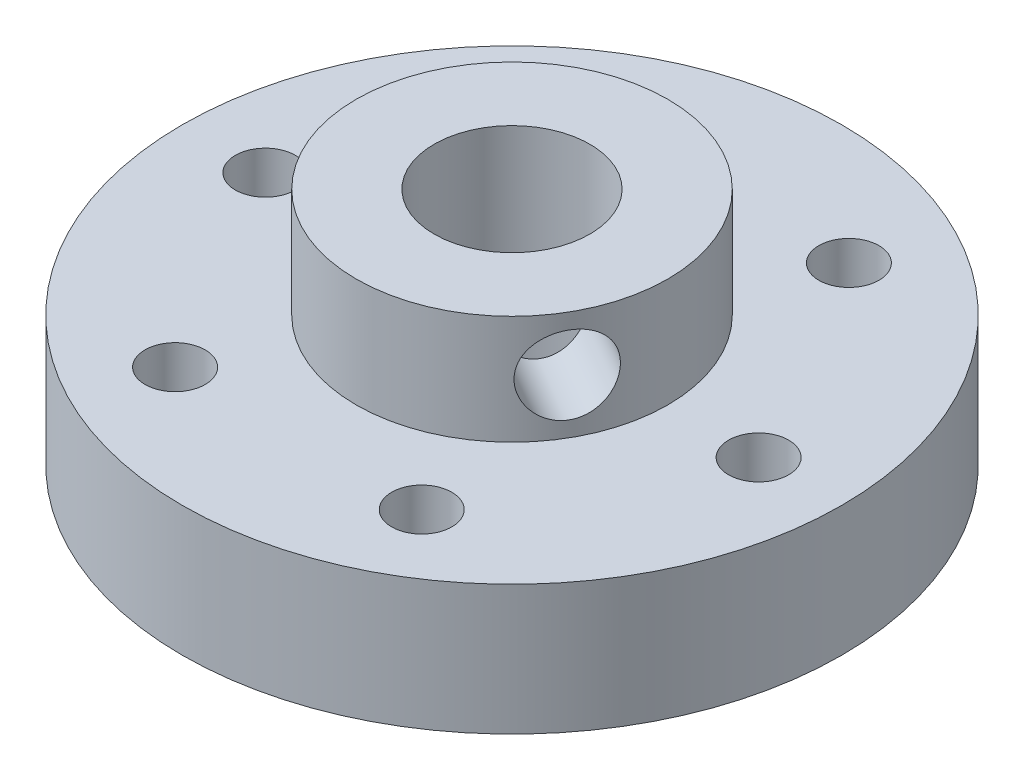
from build123d import *

# Parameters (mm, degrees)
SKETCH1_R           = 12.7
BOSS_EXTRUDE1_DEPTH = 5
SKETCH2_R           = 6
BOSS_EXTRUDE2_DEPTH = 4.2
SKETCH3_R           = 3
CUT_EXTRUDE1_DEPTH  = 21.179692763
SKETCH6_R           = 1.158179442
CUT_EXTRUDE2_DEPTH  = 19.643497526
SKETCH7_R           = 1.5
CUT_EXTRUDE3_DEPTH  = 8.2


with BuildPart() as part:
    # Sketch1 → Boss-Extrude1 (new body)
    with BuildSketch(Plane(origin=(0, 0, 0), x_dir=(1, 0, 0), z_dir=(0, 1, 0))):
        with Locations(Location((0, 0, 0), (0, 0, 270))):
            Circle(SKETCH1_R)
    extrude(amount=BOSS_EXTRUDE1_DEPTH)

    # Sketch2 → Boss-Extrude2 (add)
    with BuildSketch(Plane(origin=(0, 5, 0), x_dir=(1, 0, 0), z_dir=(0, 1, 0))):
        with Locations(Location((0, 0, 0), (0, 0, 270))):
            Circle(SKETCH2_R)
    extrude(amount=BOSS_EXTRUDE2_DEPTH)

    # Sketch3 → Cut-Extrude1 (cut, through all)
    with BuildSketch(Plane(origin=(0, 9.2, 0), x_dir=(1, 0, 0), z_dir=(0, 1, 0))):
        with Locations(Location((0, 0, 0), (0, 0, 270))):
            Circle(SKETCH3_R)
    extrude(amount=-CUT_EXTRUDE1_DEPTH, mode=Mode.SUBTRACT)

    # Sketch6 → Cut-Extrude2 (cut, through all)
    with BuildSketch(Plane(origin=(0, 5, 0), x_dir=(1, 0, 0), z_dir=(0, 1, 0))):
        with Locations(Location((-9.5, 0, 0), (0, 0, 270))):
            Circle(SKETCH6_R)
        with Locations(Location((-4.75, 8.227241336, 0), (0, 0, 270))):
            Circle(SKETCH6_R)
        with Locations(Location((4.75, 8.227241336, 0), (0, 0, 270))):
            Circle(SKETCH6_R)
        with Locations(Location((9.5, 0, 0), (0, 0, 270))):
            Circle(SKETCH6_R)
        with Locations(Location((4.75, -8.227241336, 0), (0, 0, 270))):
            Circle(SKETCH6_R)
        with Locations(Location((-4.75, -8.227241336, 0), (0, 0, 270))):
            Circle(SKETCH6_R)
    extrude(amount=-CUT_EXTRUDE2_DEPTH, mode=Mode.SUBTRACT)

    # Sketch7 → Cut-Extrude3 (cut)
    with BuildSketch(Plane(origin=(0, 5, 0), x_dir=(-0.5000000000000102, 0, 0.8660254037844328), z_dir=(-0.8660254037844328, 0, -0.5000000000000102))):
        with Locations((0, 2.1)):
            Circle(SKETCH7_R)
    extrude(amount=-CUT_EXTRUDE3_DEPTH, mode=Mode.SUBTRACT)


solid = part.part
